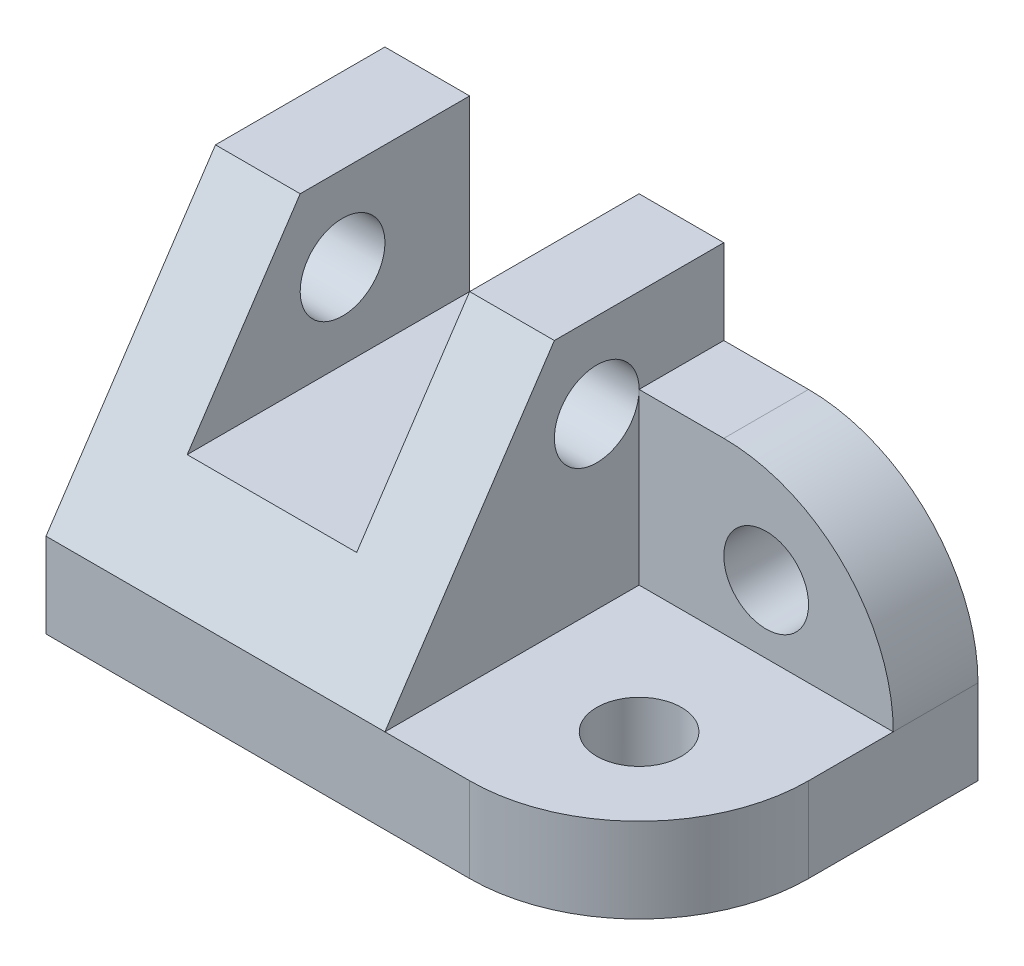
from build123d import *

# Parameters (mm, degrees)
SKETCH1_W           = 400
SKETCH1_H           = 400
BOSS_EXTRUDE1_DEPTH = 700
CUT_EXTRUDE1_DEPTH  = 700
SKETCH4_W           = 200
SKETCH4_H           = 200
CUT_EXTRUDE2_DEPTH  = 700
CUT_EXTRUDE3_DEPTH  = 300
FILLET1_R           = 200
SKETCH6_R           = 50
CUT_EXTRUDE4_DEPTH  = 300
FILLET2_R           = 200
SKETCH7_R           = 50
CUT_EXTRUDE5_DEPTH  = 228
SKETCH8_R           = 50
CUT_EXTRUDE6_DEPTH  = 708


with BuildPart() as part:
    # Sketch1 → Boss-Extrude1 (new body)
    with BuildSketch(Plane(origin=(0, 0, 0), x_dir=(0, 0, -1), z_dir=(1, 0, 0))):
        with Locations((200, 200)):
            Rectangle(SKETCH1_W, SKETCH1_H)
    extrude(amount=-BOSS_EXTRUDE1_DEPTH)

    # Sketch2 → Cut-Extrude1 (cut)
    with BuildSketch(Plane(origin=(0, 0, 0), x_dir=(0, 0, -1), z_dir=(1, 0, 0))):
        Polygon((0, 400), (0, 100), (200, 400), align=None)
    extrude(amount=-CUT_EXTRUDE1_DEPTH, mode=Mode.SUBTRACT)

    # Sketch4 → Cut-Extrude2 (cut)
    with BuildSketch(Plane(origin=(0, 0, -400), x_dir=(-1, 0, 0), z_dir=(0, 0, -1))):
        with Locations((500, 300)):
            Rectangle(SKETCH4_W, SKETCH4_H)
    extrude(amount=-CUT_EXTRUDE2_DEPTH, mode=Mode.SUBTRACT)

    # Sketch5 → Cut-Extrude3 (cut)
    with BuildSketch(Plane(origin=(0, 0, 0), x_dir=(0, 0, -1), z_dir=(1, 0, 0))):
        Polygon((0, 100), (300, 100), (300, 300), (400, 300), (400, 400), (200, 400), align=None)
    extrude(amount=-CUT_EXTRUDE3_DEPTH, mode=Mode.SUBTRACT)

    # Fillet1
    fillet1_edges = [part.edges().sort_by_distance(p)[0] for p in [
        (0, 300, -350),
    ]]
    fillet(fillet1_edges, radius=FILLET1_R)

    # Sketch6 → Cut-Extrude4 (cut)
    with BuildSketch(Plane(origin=(0, 100, 0), x_dir=(1, 0, 0), z_dir=(0, 1, 0))):
        with Locations(Location((-150, 150, 0), (0, 0, 270))):
            Circle(SKETCH6_R)
    extrude(amount=-CUT_EXTRUDE4_DEPTH, mode=Mode.SUBTRACT)

    # Fillet2
    fillet2_edges = [part.edges().sort_by_distance(p)[0] for p in [
        (0, 50, 0),
    ]]
    fillet(fillet2_edges, radius=FILLET2_R)

    # Sketch7 → Cut-Extrude5 (cut)
    with BuildSketch(Plane.XY.offset(-300)):
        with Locations((-150, 180)):
            Circle(SKETCH7_R)
    extrude(amount=-CUT_EXTRUDE5_DEPTH, mode=Mode.SUBTRACT)

    # Sketch8 → Cut-Extrude6 (cut)
    with BuildSketch(Plane.ZY.offset(700)):
        with Locations(Location((-250, 300, 0), (0, 0, 180))):
            Circle(SKETCH8_R)
    extrude(amount=-CUT_EXTRUDE6_DEPTH, mode=Mode.SUBTRACT)


solid = part.part
